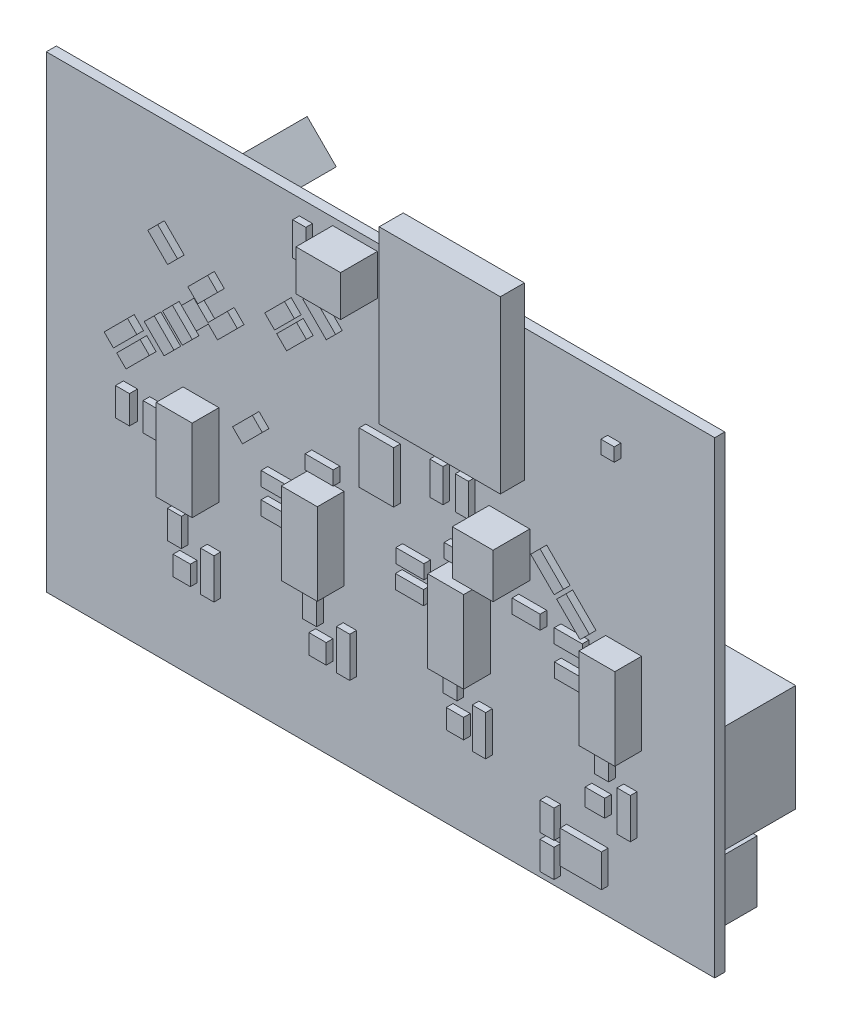
from build123d import *

# Parameters (mm, degrees)
SKETCH1_W                     = 100
SKETCH1_H                     = 70
BOARD_DEPTH                   = 1.5
SKETCH2_W                     = 9.982
SKETCH2_H                     = 9.195
EXTRUDE_W237_102_1_DEPTH      = 10
C1206FAB_1_DEPTH              = 1
C1206FAB_2_DEPTH              = 1
SKETCH5_W                     = 2.0955
SKETCH5_H                     = 4.191
C1206FAB_3_DEPTH              = 1
SKETCH6_W                     = 2.0955
SKETCH6_H                     = 4.191
C1206FAB_4_DEPTH              = 1
C1206FAB_5_DEPTH              = 1
C1206FAB_6_DEPTH              = 1
SKETCH9_W                     = 1.9914
SKETCH9_H                     = 5.9968
SOD123_1_DEPTH                = 1
SKETCH10_W                    = 1.9914
SKETCH10_H                    = 5.9968
SOD123_2_DEPTH                = 1
SKETCH11_W                    = 1.9914
SKETCH11_H                    = 5.9968
SOD123_3_DEPTH                = 1
SKETCH12_W                    = 1.9914
SKETCH12_H                    = 5.9968
SOD123_4_DEPTH                = 1
SKETCH13_W                    = 6.2
SKETCH13_H                    = 4.9016
SO08_1_DEPTH                  = 1
SKETCH14_W                    = 5.1562
SKETCH14_H                    = 7.6962
EXTRUDE_2X03_1_DEPTH          = 8.5
SKETCH15_W                    = 5.1562
SKETCH15_H                    = 7.6962
EXTRUDE_2X03_2_DEPTH          = 1
SKETCH16_W                    = 20.25
SKETCH16_H                    = 16
RELAY_SRD_05VDC_SL_C_1_DEPTH  = 15.392776168
SKETCH17_W                    = 20.25
SKETCH17_H                    = 16
RELAY_SRD_05VDC_SL_C_2_DEPTH  = 15.4
SKETCH18_W                    = 20.25
SKETCH18_H                    = 16
RELAY_SRD_05VDC_SL_C_3_DEPTH  = 15.4
SKETCH19_W                    = 20.25
SKETCH19_H                    = 16
RELAY_SRD_05VDC_SL_C_4_DEPTH  = 15.4
EXTRUDE_22_23_2021_1_DEPTH    = 12
SKETCH21_W                    = 2.921
SKETCH21_H                    = 2.5908
SOT23_1_DEPTH                 = 1
SKETCH22_W                    = 2.5908
SKETCH22_H                    = 2.921
SOT23_2_DEPTH                 = 1
SKETCH23_W                    = 2.5908
SKETCH23_H                    = 2.921
SOT23_3_DEPTH                 = 1
SKETCH24_W                    = 2.5908
SKETCH24_H                    = 2.921
SOT23_4_DEPTH                 = 1
SKETCH25_W                    = 2.0955
SKETCH25_H                    = 4.191
R1206FAB_1_DEPTH              = 1
SKETCH26_W                    = 2.0955
SKETCH26_H                    = 4.191
R1206FAB_2_DEPTH              = 1
SKETCH27_W                    = 2.0955
SKETCH27_H                    = 4.191
R1206FAB_3_DEPTH              = 1
SKETCH28_W                    = 2.0955
SKETCH28_H                    = 4.191
R1206FAB_4_DEPTH              = 1
SKETCH29_W                    = 2.0955
SKETCH29_H                    = 4.191
R1206FAB_5_DEPTH              = 1
SKETCH30_W                    = 4.191
SKETCH30_H                    = 2.0955
R1206FAB_6_DEPTH              = 1
R1206FAB_7_DEPTH              = 1
SKETCH32_W                    = 4.191
SKETCH32_H                    = 2.0955
R1206FAB_8_DEPTH              = 1
R1206FAB_9_DEPTH              = 1
R1206FAB_10_DEPTH             = 1
SKETCH35_W                    = 4.191
SKETCH35_H                    = 2.0955
R1206FAB_11_DEPTH             = 1
SKETCH36_W                    = 1.966
SKETCH36_H                    = 4.946
EXTRUDE_R1206_1_DEPTH         = 1
EXTRUDE_R1206_2_DEPTH         = 1
SKETCH38_W                    = 1.966
SKETCH38_H                    = 4.946
EXTRUDE_R1206_3_DEPTH         = 1
EXTRUDE_R1206_4_DEPTH         = 1
EXTRUDE_R1206_5_DEPTH         = 1
SKETCH41_W                    = 4.191
SKETCH41_H                    = 2.0955
R1206FAB_12_DEPTH             = 1
R1206FAB_13_DEPTH             = 1
SKETCH43_W                    = 4.191
SKETCH43_H                    = 2.0955
R1206FAB_14_DEPTH             = 1
SKETCH44_W                    = 4.191
SKETCH44_H                    = 2.0955
R1206FAB_15_DEPTH             = 1
SKETCH45_W                    = 2
SKETCH45_H                    = 2
F_1X06SMD_1_DEPTH             = 1
SKETCH46_W                    = 6.6802
SKETCH46_H                    = 6.096
F_6MM_SWITCH_1_DEPTH          = 5.5
SKETCH47_W                    = 6.096
SKETCH47_H                    = 6.6802
F_6MM_SWITCH_2_DEPTH          = 5.5
SKETCH48_W                    = 4.191
SKETCH48_H                    = 2.0955
LED1206FAB_1_DEPTH            = 1
SOT95P237X112_3N_1_DEPTH      = 1
SKETCH50_W                    = 2.0955
SKETCH50_H                    = 4.191
LED1206FAB_2_DEPTH            = 1.195199993
SKETCH51_W                    = 4.191
SKETCH51_H                    = 2.0955
LED1206FAB_3_DEPTH            = 1
SKETCH52_W                    = 4.191
SKETCH52_H                    = 2.0955
LED1206FAB_4_DEPTH            = 1
TEMP_HUM_SENSOR_DHT11_1_DEPTH = 25
LED1206_1_DEPTH               = 1
LED1206_2_DEPTH               = 1
SKETCH56_W                    = 1.966
SKETCH56_H                    = 4.946
LED1206_3_DEPTH               = 1
SKETCH57_W                    = 18.127
SKETCH57_H                    = 25.5635
ESP_WROOM_32_1_DEPTH          = 3.6
SKETCH58_W                    = 5.38
SKETCH58_H                    = 12.26
SOIC254P1030X460_4N_1_DEPTH   = 4
SKETCH59_W                    = 5.38
SKETCH59_H                    = 12.26
SOIC254P1030X460_4N_2_DEPTH   = 4
SKETCH60_W                    = 5.38
SKETCH60_H                    = 12.26
SOIC254P1030X460_4N_3_DEPTH   = 4
SKETCH61_W                    = 5.38
SKETCH61_H                    = 12.26
SOIC254P1030X460_4N_4_DEPTH   = 4
SKETCH62_W                    = 9.982
SKETCH62_H                    = 9.195
EXTRUDE_W237_102_2_DEPTH      = 10
EXTRUDE_W237_102_3_DEPTH      = 1
EXTRUDE_W237_102_3_DEPTH_BACK = 10
SKETCH63_W                    = 9.982
SKETCH63_H                    = 9.195
EXTRUDE_W237_102_4_DEPTH      = 1
EXTRUDE_W237_102_4_DEPTH_BACK = 10
SKETCH64_W                    = 9.982
SKETCH64_H                    = 9.195
XTAL_ECS_327_12_5_13X_1_DEPTH = 6.5


with BuildPart() as part:
    # Sketch1 → BOARD (new body)
    with BuildSketch(Plane.XY):
        with Locations((49.99935, 35)):
            Rectangle(SKETCH1_W, SKETCH1_H)
    extrude(amount=BOARD_DEPTH)


with BuildPart() as body_2:
    # Sketch2 → Extrude W237-102-1 (new body)
    with BuildSketch(Plane.XY):
        with Locations((89.84135, 5.4865)):
            Rectangle(SKETCH2_W, SKETCH2_H)
    extrude(amount=-EXTRUDE_W237_102_1_DEPTH)


with BuildPart() as body_3:
    # Sketch3 → C1206FAB-1 (new body)
    with BuildSketch(Plane.XY.offset(1.5)):
        Polygon((19.87090751, 47.59662703), (22.83439203, 44.63314251), (21.35264977, 43.15140025), (18.38916525, 46.11488477), align=None)
    extrude(amount=C1206FAB_1_DEPTH)


with BuildPart() as body_4:
    # Sketch4 → C1206FAB-2 (new body)
    with BuildSketch(Plane.XY.offset(1.5)):
        Polygon((18.61366749, 40.41241997), (15.65018297, 43.37590449), (17.13192523, 44.85764675), (20.09540975, 41.89416223), align=None)
    extrude(amount=C1206FAB_2_DEPTH)


with BuildPart() as body_5:
    # Sketch5 → C1206FAB-3 (new body)
    with BuildSketch(Plane.XY.offset(1.5)):
        with Locations((75.9011, 8.89)):
            Rectangle(SKETCH5_W, SKETCH5_H)
    extrude(amount=C1206FAB_3_DEPTH)


with BuildPart() as body_6:
    # Sketch6 → C1206FAB-4 (new body)
    with BuildSketch(Plane.XY.offset(1.5)):
        with Locations((75.9011, 3.81)):
            Rectangle(SKETCH6_W, SKETCH6_H)
    extrude(amount=C1206FAB_4_DEPTH)


with BuildPart() as body_7:
    # Sketch7 → C1206FAB-5 (new body)
    with BuildSketch(Plane.XY.offset(1.5)):
        Polygon((33.67100497, 53.50369851), (36.63448949, 56.46718303), (38.11623175, 54.98544077), (35.15274723, 52.02195625), align=None)
    extrude(amount=C1206FAB_5_DEPTH)


with BuildPart() as body_8:
    # Sketch8 → C1206FAB-6 (new body)
    with BuildSketch(Plane.XY.offset(1.5)):
        Polygon((35.46705797, 51.70764251), (38.43054249, 54.67112703), (39.91228475, 53.18938477), (36.94880023, 50.22590025), align=None)
    extrude(amount=C1206FAB_6_DEPTH)


with BuildPart() as body_9:
    # Sketch9 → SOD123-1 (new body)
    with BuildSketch(Plane.XY.offset(1.5)):
        with Locations((87.372691, 15.3246)):
            Rectangle(SKETCH9_W, SKETCH9_H)
    extrude(amount=SOD123_1_DEPTH)


with BuildPart() as body_10:
    # Sketch10 → SOD123-2 (new body)
    with BuildSketch(Plane.XY.offset(1.5)):
        with Locations((25.08205, 15.24)):
            Rectangle(SKETCH10_W, SKETCH10_H)
    extrude(amount=SOD123_2_DEPTH)


with BuildPart() as body_11:
    # Sketch11 → SOD123-3 (new body)
    with BuildSketch(Plane.XY.offset(1.5)):
        with Locations((45.40205, 15.24)):
            Rectangle(SKETCH11_W, SKETCH11_H)
    extrude(amount=SOD123_3_DEPTH)


with BuildPart() as body_12:
    # Sketch12 → SOD123-4 (new body)
    with BuildSketch(Plane.XY.offset(1.5)):
        with Locations((65.72205, 15.24)):
            Rectangle(SKETCH12_W, SKETCH12_H)
    extrude(amount=SOD123_4_DEPTH)


with BuildPart() as body_13:
    # Sketch13 → SO08-1 (new body)
    with BuildSketch(Plane.XY.offset(1.5)):
        with Locations((80.94935, 6.4008)):
            Rectangle(SKETCH13_W, SKETCH13_H)
    extrude(amount=SO08_1_DEPTH)


with BuildPart() as body_14:
    # Sketch14 → Extrude 2X03-1 (new body)
    with BuildSketch(Plane.XY):
        with Locations((81.056428, 46.512759)):
            Rectangle(SKETCH14_W, SKETCH14_H)
    extrude(amount=-EXTRUDE_2X03_1_DEPTH)


with BuildPart() as body_15:
    # Sketch15 → Extrude 2X03-2 (new body)
    with BuildSketch(Plane.XY.offset(1.5)):
        with Locations((50.378181, 41.827859)):
            Rectangle(SKETCH15_W, SKETCH15_H)
    extrude(amount=EXTRUDE_2X03_2_DEPTH)


with BuildPart() as body_16:
    # Sketch16 → RELAY_SRD-05VDC-SL-C-1 (new body)
    with BuildSketch(Plane.XY):
        with Locations((21.58435, 19.05)):
            Rectangle(SKETCH16_W, SKETCH16_H)
    extrude(amount=-RELAY_SRD_05VDC_SL_C_1_DEPTH)


with BuildPart() as body_17:
    # Sketch17 → RELAY_SRD-05VDC-SL-C-2 (new body)
    with BuildSketch(Plane.XY):
        with Locations((85.08435, 19.05)):
            Rectangle(SKETCH17_W, SKETCH17_H)
    extrude(amount=-RELAY_SRD_05VDC_SL_C_2_DEPTH)


with BuildPart() as body_18:
    # Sketch18 → RELAY_SRD-05VDC-SL-C-3 (new body)
    with BuildSketch(Plane.XY):
        with Locations((41.90435, 19.05)):
            Rectangle(SKETCH18_W, SKETCH18_H)
    extrude(amount=-RELAY_SRD_05VDC_SL_C_3_DEPTH)


with BuildPart() as body_19:
    # Sketch19 → RELAY_SRD-05VDC-SL-C-4 (new body)
    with BuildSketch(Plane.XY):
        with Locations((62.22435, 19.05)):
            Rectangle(SKETCH19_W, SKETCH19_H)
    extrude(amount=-RELAY_SRD_05VDC_SL_C_4_DEPTH)


with BuildPart() as body_20:
    # Sketch20 → Extrude 22-23-2021-1 (new body)
    with BuildSketch(Plane.XY):
        Polygon((31.338150806, 40.730445623), (35.109858377, 44.502153194), (30.529927755, 49.082083816), (26.758220184, 45.310376245), align=None)
    extrude(amount=-EXTRUDE_22_23_2021_1_DEPTH)


with BuildPart() as body_21:
    # Sketch21 → SOT23-1 (new body)
    with BuildSketch(Plane.XY.offset(1.5)):
        with Locations((83.074159, 14.756188)):
            Rectangle(SKETCH21_W, SKETCH21_H)
    extrude(amount=SOT23_1_DEPTH)


with BuildPart() as body_22:
    # Sketch22 → SOT23-2 (new body)
    with BuildSketch(Plane.XY.offset(1.5)):
        with Locations((21.25935, 13.9319)):
            Rectangle(SKETCH22_W, SKETCH22_H)
    extrude(amount=SOT23_2_DEPTH)


with BuildPart() as body_23:
    # Sketch23 → SOT23-3 (new body)
    with BuildSketch(Plane.XY.offset(1.5)):
        with Locations((41.57935, 13.9319)):
            Rectangle(SKETCH23_W, SKETCH23_H)
    extrude(amount=SOT23_3_DEPTH)


with BuildPart() as body_24:
    # Sketch24 → SOT23-4 (new body)
    with BuildSketch(Plane.XY.offset(1.5)):
        with Locations((62.131128, 14.514703)):
            Rectangle(SKETCH24_W, SKETCH24_H)
    extrude(amount=SOT23_4_DEPTH)


with BuildPart() as body_25:
    # Sketch25 → R1206FAB-1 (new body)
    with BuildSketch(Plane.XY.offset(1.5)):
        with Locations((84.094472, 20.560384)):
            Rectangle(SKETCH25_W, SKETCH25_H)
    extrude(amount=R1206FAB_1_DEPTH)


with BuildPart() as body_26:
    # Sketch26 → R1206FAB-2 (new body)
    with BuildSketch(Plane.XY.offset(1.5)):
        with Locations((20.154631, 18.815884)):
            Rectangle(SKETCH26_W, SKETCH26_H)
    extrude(amount=R1206FAB_2_DEPTH)


with BuildPart() as body_27:
    # Sketch27 → R1206FAB-3 (new body)
    with BuildSketch(Plane.XY.offset(1.5)):
        with Locations((16.519059, 30.952416)):
            Rectangle(SKETCH27_W, SKETCH27_H)
    extrude(amount=R1206FAB_3_DEPTH)


with BuildPart() as body_28:
    # Sketch28 → R1206FAB-4 (new body)
    with BuildSketch(Plane.XY.offset(1.5)):
        with Locations((40.387775, 18.814672)):
            Rectangle(SKETCH28_W, SKETCH28_H)
    extrude(amount=R1206FAB_4_DEPTH)


with BuildPart() as body_29:
    # Sketch29 → R1206FAB-5 (new body)
    with BuildSketch(Plane.XY.offset(1.5)):
        with Locations((61.400641, 19.712094)):
            Rectangle(SKETCH29_W, SKETCH29_H)
    extrude(amount=R1206FAB_5_DEPTH)


with BuildPart() as body_30:
    # Sketch30 → R1206FAB-6 (new body)
    with BuildSketch(Plane.XY.offset(1.5)):
        with Locations((55.321953, 28.477716)):
            Rectangle(SKETCH30_W, SKETCH30_H)
    extrude(amount=R1206FAB_6_DEPTH)


with BuildPart() as body_31:
    # Sketch31 → R1206FAB-7 (new body)
    with BuildSketch(Plane.XY.offset(1.5)):
        Polygon((29.57476703, 49.43452349), (26.61128251, 46.47103897), (25.12954025, 47.95278123), (28.09302477, 50.91626575), align=None)
    extrude(amount=R1206FAB_7_DEPTH)


with BuildPart() as body_32:
    # Sketch32 → R1206FAB-8 (new body)
    with BuildSketch(Plane.XY.offset(1.5)):
        with Locations((35.22935, 27.97175)):
            Rectangle(SKETCH32_W, SKETCH32_H)
    extrude(amount=R1206FAB_8_DEPTH)


with BuildPart() as body_33:
    # Sketch33 → R1206FAB-9 (new body)
    with BuildSketch(Plane.XY.offset(1.5)):
        Polygon((22.17718597, 51.14958851), (25.14067049, 54.11307303), (26.62241275, 52.63133077), (23.65892823, 49.66784625), align=None)
    extrude(amount=R1206FAB_9_DEPTH)


with BuildPart() as body_34:
    # Sketch34 → R1206FAB-10 (new body)
    with BuildSketch(Plane.XY.offset(1.5)):
        Polygon((19.14398949, 52.50263297), (16.18050497, 55.46611749), (17.66224723, 56.94785975), (20.62573175, 53.98437523), align=None)
    extrude(amount=R1206FAB_10_DEPTH)


with BuildPart() as body_35:
    # Sketch35 → R1206FAB-11 (new body)
    with BuildSketch(Plane.XY.offset(1.5)):
        with Locations((79.110606, 28.913522)):
            Rectangle(SKETCH35_W, SKETCH35_H)
    extrude(amount=R1206FAB_11_DEPTH)


with BuildPart() as body_36:
    # Sketch36 → Extrude R1206-1 (new body)
    with BuildSketch(Plane.XY.offset(1.5)):
        with Locations((38.836075, 65.192103)):
            Rectangle(SKETCH36_W, SKETCH36_H)
    extrude(amount=EXTRUDE_R1206_1_DEPTH)


with BuildPart() as body_37:
    # Sketch37 → Extrude R1206-2 (new body)
    with BuildSketch(Plane.XY.offset(1.5)):
        Polygon((11.531722964, 37.252391896), (15.029073104, 40.749742036), (16.419245036, 39.359570104), (12.921894896, 35.862219964), align=None)
    extrude(amount=EXTRUDE_R1206_2_DEPTH)


with BuildPart() as body_38:
    # Sketch38 → Extrude R1206-3 (new body)
    with BuildSketch(Plane.XY.offset(1.5)):
        with Locations((63.16935, 44.45)):
            Rectangle(SKETCH38_W, SKETCH38_H)
    extrude(amount=EXTRUDE_R1206_3_DEPTH)


with BuildPart() as body_39:
    # Sketch39 → Extrude R1206-4 (new body)
    with BuildSketch(Plane.XY.offset(1.5)):
        Polygon((40.776688896, 59.514036036), (44.274039036, 56.016685896), (42.883867104, 54.626513964), (39.386516964, 58.123864104), align=None)
    extrude(amount=EXTRUDE_R1206_4_DEPTH)


with BuildPart() as body_40:
    # Sketch40 → Extrude R1206-5 (new body)
    with BuildSketch(Plane.XY.offset(1.5)):
        Polygon((76.967236104, 38.642060964), (73.469885964, 42.139411104), (74.860057896, 43.529583036), (78.357408036, 40.032232896), align=None)
    extrude(amount=EXTRUDE_R1206_5_DEPTH)


with BuildPart() as body_41:
    # Sketch41 → R1206FAB-12 (new body)
    with BuildSketch(Plane.XY.offset(1.5)):
        with Locations((72.773688, 34.02805)):
            Rectangle(SKETCH41_W, SKETCH41_H)
    extrude(amount=R1206FAB_12_DEPTH)


with BuildPart() as body_42:
    # Sketch42 → R1206FAB-13 (new body)
    with BuildSketch(Plane.XY.offset(1.5)):
        Polygon((33.30790803, 37.83010449), (30.34442351, 34.86661997), (28.86268125, 36.34836223), (31.82616577, 39.31184675), align=None)
    extrude(amount=R1206FAB_13_DEPTH)


with BuildPart() as body_43:
    # Sketch43 → R1206FAB-14 (new body)
    with BuildSketch(Plane.XY.offset(1.5)):
        with Locations((41.813175, 37.228706)):
            Rectangle(SKETCH43_W, SKETCH43_H)
    extrude(amount=R1206FAB_14_DEPTH)


with BuildPart() as body_44:
    # Sketch44 → R1206FAB-15 (new body)
    with BuildSketch(Plane.XY.offset(1.5)):
        with Locations((62.608906, 36.142872)):
            Rectangle(SKETCH44_W, SKETCH44_H)
    extrude(amount=R1206FAB_15_DEPTH)


with BuildPart() as body_45:
    # Sketch45 → 1X06SMD-1 (new body)
    with BuildSketch(Plane.XY.offset(1.5)):
        with Locations((84.963222, 61.295572)):
            Rectangle(SKETCH45_W, SKETCH45_H)
    extrude(amount=F_1X06SMD_1_DEPTH)


with BuildPart() as body_46:
    # Sketch46 → 6MM_SWITCH-1 (new body)
    with BuildSketch(Plane.XY.offset(1.5)):
        with Locations((46.185453, 65.854969)):
            Rectangle(SKETCH46_W, SKETCH46_H)
    extrude(amount=F_6MM_SWITCH_1_DEPTH)


with BuildPart() as body_47:
    # Sketch47 → 6MM_SWITCH-2 (new body)
    with BuildSketch(Plane.XY.offset(1.5)):
        with Locations((69.280578, 41.000675)):
            Rectangle(SKETCH47_W, SKETCH47_H)
    extrude(amount=F_6MM_SWITCH_2_DEPTH)


with BuildPart() as body_48:
    # Sketch48 → LED1206FAB-1 (new body)
    with BuildSketch(Plane.XY.offset(1.5)):
        with Locations((55.390169, 31.870466)):
            Rectangle(SKETCH48_W, SKETCH48_H)
    extrude(amount=LED1206FAB_1_DEPTH)


with BuildPart() as body_49:
    # Sketch49 → SOT95P237X112-3N-1 (new body)
    with BuildSketch(Plane.XY.offset(1.5)):
        Polygon((21.217944092, 48.243206635), (23.085837365, 50.111099908), (25.294980371, 47.901956902), (23.427087098, 46.034063629), align=None)
    extrude(amount=SOT95P237X112_3N_1_DEPTH)


with BuildPart() as body_50:
    # Sketch50 → LED1206FAB-2 (new body)
    with BuildSketch(Plane.XY.offset(1.5)):
        with Locations((12.589675, 31.032003)):
            Rectangle(SKETCH50_W, SKETCH50_H)
    extrude(amount=LED1206FAB_2_DEPTH)


with BuildPart() as body_51:
    # Sketch51 → LED1206FAB-3 (new body)
    with BuildSketch(Plane.XY.offset(1.5)):
        with Locations((35.22935, 31.78175)):
            Rectangle(SKETCH51_W, SKETCH51_H)
    extrude(amount=LED1206FAB_3_DEPTH)


with BuildPart() as body_52:
    # Sketch52 → LED1206FAB-4 (new body)
    with BuildSketch(Plane.XY.offset(1.5)):
        with Locations((79.082547, 33.327303)):
            Rectangle(SKETCH52_W, SKETCH52_H)
    extrude(amount=LED1206FAB_4_DEPTH)


with BuildPart() as body_53:
    # Sketch53 → TEMP-HUM-SENSOR-DHT11-1 (new body)
    with BuildSketch(Plane.XY):
        Polygon((12.523426836, 54.635981846), (3.453368154, 45.565923164), (7.808792373, 41.210498945), (16.878851055, 50.280557627), align=None)
    extrude(amount=-TEMP_HUM_SENSOR_DHT11_1_DEPTH)


with BuildPart() as body_54:
    # Sketch54 → LED1206-1 (new body)
    with BuildSketch(Plane.XY.offset(1.5)):
        Polygon((78.740269896, 39.648458036), (82.237620036, 36.151107896), (80.847448104, 34.760935964), (77.350097964, 38.258286104), align=None)
    extrude(amount=LED1206_1_DEPTH)


with BuildPart() as body_55:
    # Sketch55 → LED1206-2 (new body)
    with BuildSketch(Plane.XY.offset(1.5)):
        Polygon((9.650601964, 39.031185896), (13.147952104, 42.528536036), (14.538124036, 41.138364104), (11.040773896, 37.641013964), align=None)
    extrude(amount=LED1206_2_DEPTH)


with BuildPart() as body_56:
    # Sketch56 → LED1206-3 (new body)
    with BuildSketch(Plane.XY.offset(1.5)):
        with Locations((59.35935, 44.45)):
            Rectangle(SKETCH56_W, SKETCH56_H)
    extrude(amount=LED1206_3_DEPTH)


with BuildPart() as body_57:
    # Sketch57 → ESP-WROOM-32-1 (new body)
    with BuildSketch(Plane.XY.offset(1.5)):
        with Locations((62.460475, 63.043638)):
            Rectangle(SKETCH57_W, SKETCH57_H)
    extrude(amount=ESP_WROOM_32_1_DEPTH)


with BuildPart() as body_58:
    # Sketch58 → SOIC254P1030X460-4N-1 (new body)
    with BuildSketch(Plane.XY.offset(1.5)):
        with Locations((86.362366, 30.083359)):
            Rectangle(SKETCH58_W, SKETCH58_H)
    extrude(amount=SOIC254P1030X460_4N_1_DEPTH)


with BuildPart() as body_59:
    # Sketch59 → SOIC254P1030X460-4N-2 (new body)
    with BuildSketch(Plane.XY.offset(1.5)):
        with Locations((23.1354, 30.676125)):
            Rectangle(SKETCH59_W, SKETCH59_H)
    extrude(amount=SOIC254P1030X460_4N_2_DEPTH)


with BuildPart() as body_60:
    # Sketch60 → SOIC254P1030X460-4N-3 (new body)
    with BuildSketch(Plane.XY.offset(1.5)):
        with Locations((41.852228, 29.198025)):
            Rectangle(SKETCH60_W, SKETCH60_H)
    extrude(amount=SOIC254P1030X460_4N_3_DEPTH)


with BuildPart() as body_61:
    # Sketch61 → SOIC254P1030X460-4N-4 (new body)
    with BuildSketch(Plane.XY.offset(1.5)):
        with Locations((63.746975, 28.765966)):
            Rectangle(SKETCH61_W, SKETCH61_H)
    extrude(amount=SOIC254P1030X460_4N_4_DEPTH)


with BuildPart() as body_62:
    # Sketch62 → Extrude W237-102-2 (new body)
    with BuildSketch(Plane.XY):
        with Locations((26.34135, 5.4865)):
            Rectangle(SKETCH62_W, SKETCH62_H)
    extrude(amount=-EXTRUDE_W237_102_2_DEPTH)


with BuildPart() as body_63:
    # Sketch63 → Extrude W237-102-3 (new, two sides: drawn at the far end of the back side and taken through both)
    with BuildSketch(Plane.XY.offset(-EXTRUDE_W237_102_3_DEPTH_BACK)):
        with Locations((46.66135, 5.4865)):
            Rectangle(SKETCH63_W, SKETCH63_H)
    extrude(amount=EXTRUDE_W237_102_3_DEPTH + EXTRUDE_W237_102_3_DEPTH_BACK)


with BuildPart() as body_64:
    # Sketch64 → Extrude W237-102-4 (new, two sides: drawn at the far end of the back side and taken through both)
    with BuildSketch(Plane.XY.offset(-EXTRUDE_W237_102_4_DEPTH_BACK)):
        with Locations((66.98135, 5.4865)):
            Rectangle(SKETCH64_W, SKETCH64_H)
    extrude(amount=EXTRUDE_W237_102_4_DEPTH + EXTRUDE_W237_102_4_DEPTH_BACK)


with BuildPart() as body_65:
    # Sketch65 → XTAL_ECS-_327-12_5-13X-1 (new body)
    with BuildSketch(Plane.XY):
        Polygon((42.28002997, 55.646194), (40.406197, 57.52002697), (38.53236403, 55.646194), (40.406197, 53.77236103), align=None)
    extrude(amount=-XTAL_ECS_327_12_5_13X_1_DEPTH)


solid = Compound([part.part, body_2.part, body_3.part, body_4.part, body_5.part, body_6.part, body_7.part, body_8.part, body_9.part, body_10.part, body_11.part, body_12.part, body_13.part, body_14.part, body_15.part, body_16.part, body_17.part, body_18.part, body_19.part, body_20.part, body_21.part, body_22.part, body_23.part, body_24.part, body_25.part, body_26.part, body_27.part, body_28.part, body_29.part, body_30.part, body_31.part, body_32.part, body_33.part, body_34.part, body_35.part, body_36.part, body_37.part, body_38.part, body_39.part, body_40.part, body_41.part, body_42.part, body_43.part, body_44.part, body_45.part, body_46.part, body_47.part, body_48.part, body_49.part, body_50.part, body_51.part, body_52.part, body_53.part, body_54.part, body_55.part, body_56.part, body_57.part, body_58.part, body_59.part, body_60.part, body_61.part, body_62.part, body_63.part, body_64.part, body_65.part])
